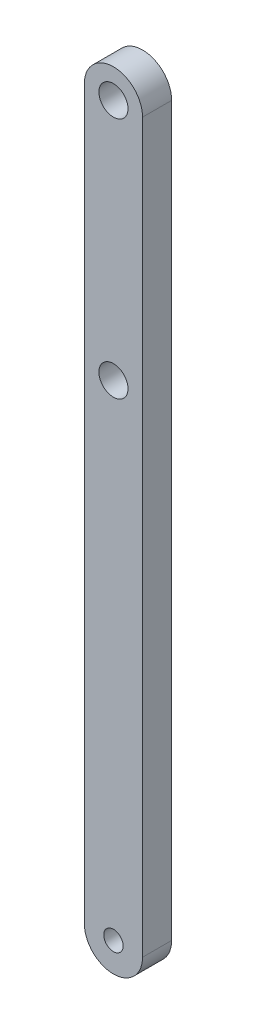
from build123d import *

# Parameters (mm, degrees)
SKETCH2_R           = 3
SKETCH2_R_2         = 2
BOSS_EXTRUDE1_DEPTH = 6
SCALE1_SCALE        = 0.5


with BuildPart() as part:
    # Sketch2 → Boss-Extrude1 (new body)
    with BuildSketch(Plane.XY):
        with BuildLine():
            Line((6, 75), (6, -75))
            ThreePointArc((6, -75), (0, -81), (-6, -75))
            Line((-6, -75), (-6, 75))
            ThreePointArc((-6, 75), (0, 81), (6, 75))
        make_face()
        with Locations((0, 75)):
            Circle(SKETCH2_R, mode=Mode.SUBTRACT)
        with Locations((0, 25)):
            Circle(SKETCH2_R, mode=Mode.SUBTRACT)
        with Locations((0, -75)):
            Circle(SKETCH2_R_2, mode=Mode.SUBTRACT)
    extrude(amount=-BOSS_EXTRUDE1_DEPTH)


with BuildPart() as part_1:
    # Scale1: scaled about (0, -1.022220005, -3)
    add(part.part.scale(SCALE1_SCALE).moved(Location((0, -0.511110003, -1.5))))


solid = part_1.part
